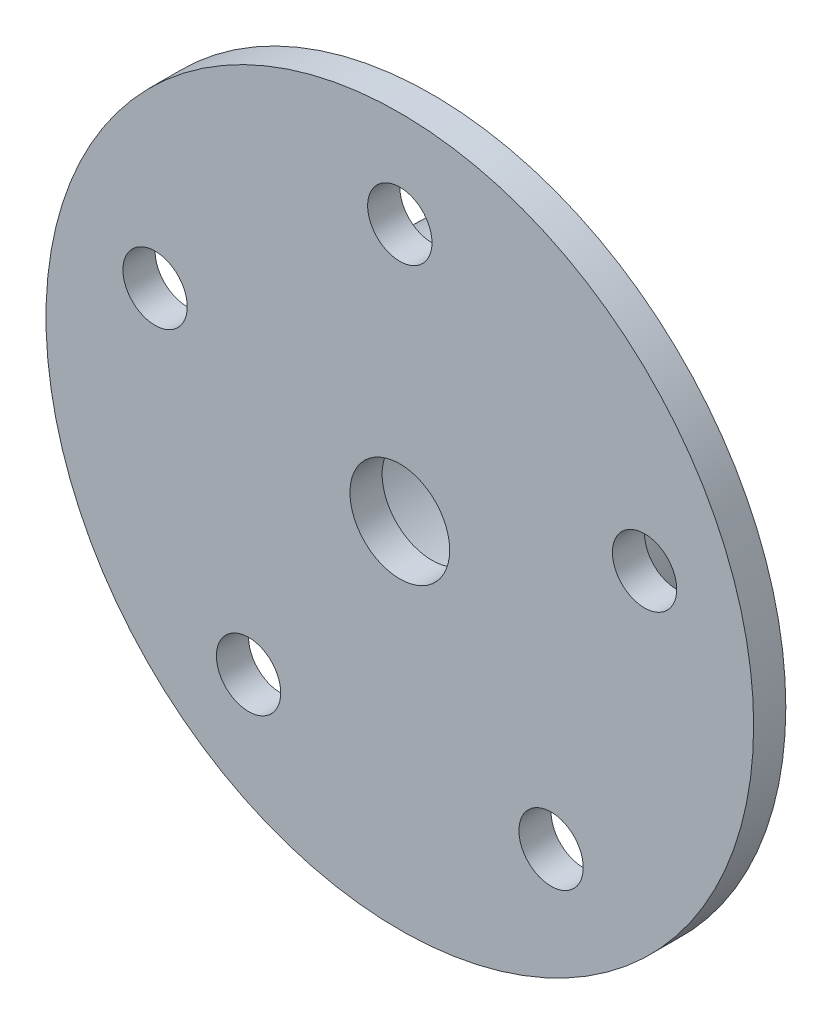
from build123d import *

# Parameters (mm, degrees)
SKETCH_1_R      = 22
SKETCH_1_R_2    = 3.1
SKETCH_1_R_3    = 2
EXTRUDE_1_DEPTH = 2
SKETCH_3_R      = 11
SKETCH_3_R_2    = 7.6
EXTRUDE_2_DEPTH = 7


with BuildPart() as part:
    # 草图1 → 凸台-拉伸1 (new body)
    with BuildSketch(Plane.XY):
        Circle(SKETCH_1_R)
        Circle(SKETCH_1_R_2, mode=Mode.SUBTRACT)
        with Locations((0, 16)):
            Circle(SKETCH_1_R_3, mode=Mode.SUBTRACT)
        with Locations((15.216904261, 4.94427191)):
            Circle(SKETCH_1_R_3, mode=Mode.SUBTRACT)
        with Locations((9.404564037, -12.94427191)):
            Circle(SKETCH_1_R_3, mode=Mode.SUBTRACT)
        with Locations((-9.404564037, -12.94427191)):
            Circle(SKETCH_1_R_3, mode=Mode.SUBTRACT)
        with Locations((-15.216904261, 4.94427191)):
            Circle(SKETCH_1_R_3, mode=Mode.SUBTRACT)
    extrude(amount=EXTRUDE_1_DEPTH)

    # 草图3 → 凸台-拉伸2 (add)
    with BuildSketch(Plane(origin=(0, 0, 0), x_dir=(-1, 0, 0), z_dir=(0, 0, -1))):
        with Locations(Location((0, 0, 0), (0, 0, 180))):
            Circle(SKETCH_3_R)
        Circle(SKETCH_3_R_2, mode=Mode.SUBTRACT)
    extrude(amount=EXTRUDE_2_DEPTH)


solid = part.part
